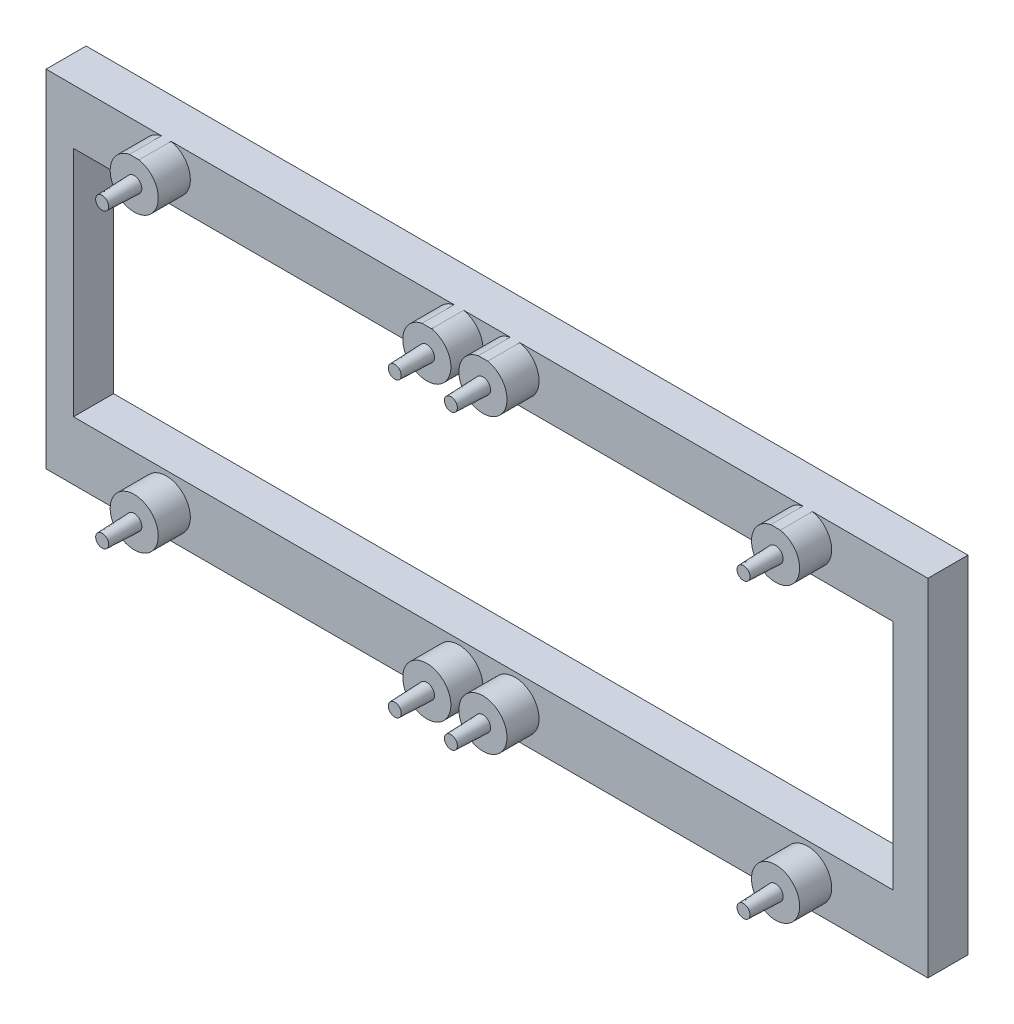
from build123d import *

# Parameters (mm, degrees)
SKIZZE1_W                                  = 110
SKIZZE1_H                                  = 170
AUFSATZ_LINEAR_AUSTRAGEN1_DEPTH            = 5
VERRUNDUNG1_R                              = 5
SKIZZE7_W                                  = 12
SKIZZE7_H                                  = 16
AUFSATZ_LINEAR_AUSTRAGEN3_DEPTH            = 28
VERRUNDUNG2_R                              = 2
SKIZZE8_R                                  = 4.2
SCHNITT_LINEAR_AUSTRAGEN3_DEPTH            = 107.484740691
LINEARES_MUSTER1_COUNT                     = 2
LINEARES_MUSTER1_PITCH                     = 134
LINEARES_MUSTER1_COUNT_DIR2                = 2
LINEARES_MUSTER1_PITCH_DIR2                = 98
SKIZZE9_R                                  = 3
AUFSATZ_LINEAR_AUSTRAGEN4_DEPTH            = 4
SKIZZE10_R                                 = 0.95
AUFSATZ_LINEAR_AUSTRAGEN5_DEPTH            = 4
AUFSATZ_LINEAR_AUSTRAGEN5_DRAFT            = 2
AUFSATZ_LINEAR_AUSTRAGEN5_PROFILE_2_DEPTH  = 4
AUFSATZ_LINEAR_AUSTRAGEN5_PROFILE_2_DRAFT  = 2
AUFSATZ_LINEAR_AUSTRAGEN5_PROFILE_3_DEPTH  = 4
AUFSATZ_LINEAR_AUSTRAGEN5_PROFILE_3_DRAFT  = 2
AUFSATZ_LINEAR_AUSTRAGEN5_PROFILE_4_DEPTH  = 4
AUFSATZ_LINEAR_AUSTRAGEN5_PROFILE_4_DRAFT  = 2
AUFSATZ_LINEAR_AUSTRAGEN5_PROFILE_5_DEPTH  = 4
AUFSATZ_LINEAR_AUSTRAGEN5_PROFILE_5_DRAFT  = 2
AUFSATZ_LINEAR_AUSTRAGEN5_PROFILE_6_DEPTH  = 4
AUFSATZ_LINEAR_AUSTRAGEN5_PROFILE_6_DRAFT  = 2
AUFSATZ_LINEAR_AUSTRAGEN5_PROFILE_7_DEPTH  = 4
AUFSATZ_LINEAR_AUSTRAGEN5_PROFILE_7_DRAFT  = 2
AUFSATZ_LINEAR_AUSTRAGEN5_PROFILE_8_DEPTH  = 4
AUFSATZ_LINEAR_AUSTRAGEN5_PROFILE_8_DRAFT  = 2
AUFSATZ_LINEAR_AUSTRAGEN5_PROFILE_9_DEPTH  = 4
AUFSATZ_LINEAR_AUSTRAGEN5_PROFILE_9_DRAFT  = 2
AUFSATZ_LINEAR_AUSTRAGEN5_PROFILE_10_DEPTH = 4
AUFSATZ_LINEAR_AUSTRAGEN5_PROFILE_10_DRAFT = 2
AUFSATZ_LINEAR_AUSTRAGEN5_PROFILE_11_DEPTH = 4
AUFSATZ_LINEAR_AUSTRAGEN5_PROFILE_11_DRAFT = 2
AUFSATZ_LINEAR_AUSTRAGEN5_PROFILE_12_DEPTH = 4
AUFSATZ_LINEAR_AUSTRAGEN5_PROFILE_12_DRAFT = 2
FASE1_SIZE                                 = 1.2
SKIZZE11_W                                 = 60
SKIZZE11_H                                 = 20
SCHNITT_LINEAR_AUSTRAGEN4_DEPTH            = 106.0428484
SKIZZE12_R                                 = 1.75
AUFSATZ_LINEAR_AUSTRAGEN6_DEPTH            = 4
AUFSATZ_LINEAR_AUSTRAGEN6_DRAFT            = 2
AUFSATZ_LINEAR_AUSTRAGEN6_PROFILE_2_DEPTH  = 4
AUFSATZ_LINEAR_AUSTRAGEN6_PROFILE_2_DRAFT  = 2
AUFSATZ_LINEAR_AUSTRAGEN6_PROFILE_3_DEPTH  = 4
AUFSATZ_LINEAR_AUSTRAGEN6_PROFILE_3_DRAFT  = 2
AUFSATZ_LINEAR_AUSTRAGEN6_PROFILE_4_DEPTH  = 4
AUFSATZ_LINEAR_AUSTRAGEN6_PROFILE_4_DRAFT  = 2
SKIZZE13_R                                 = 2
SCHNITT_LINEAR_AUSTRAGEN5_DEPTH            = 4.5
SKIZZE15_W                                 = 8
SKIZZE15_H                                 = 50
SCHNITT_LINEAR_AUSTRAGEN6_DEPTH            = 107.179093987
VERRUNDUNG3_R                              = 1
SCHNITT_LINEAR_AUSTRAGEN7_DEPTH            = 107.179093987
SCHNITT_LINEAR_AUSTRAGEN7_DEPTH_BACK       = 107.179093987
SKIZZE16_W                                 = 135.64748715
SKIZZE16_H                                 = 104.662159392
SKIZZE16_H_2                               = 34.255387719
SKIZZE16_W_2                               = 102.195469564
SKIZZE16_H_3                               = 29.000658893


with BuildPart() as part:
    # Skizze1 → Aufsatz-Linear austragen1 (new body)
    with BuildSketch(Plane.XY):
        Rectangle(SKIZZE1_W, SKIZZE1_H)
    extrude(amount=AUFSATZ_LINEAR_AUSTRAGEN1_DEPTH)

    # Verrundung1
    verrundung1_edges = [part.edges().sort_by_distance(p)[0] for p in [
        (55, -85, 2.5),
        (-55, -85, 2.5),
        (-55, 85, 2.5),
        (55, 85, 2.5),
    ]]
    fillet(verrundung1_edges, radius=VERRUNDUNG1_R)

    # Skizze7 → Aufsatz-Linear austragen3 (add)
    with BuildSketch(Plane.XY.offset(5)):
        with Locations((-49, 65)):
            Rectangle(SKIZZE7_W, SKIZZE7_H)
        with Locations((49, 65)):
            Rectangle(SKIZZE7_W, SKIZZE7_H)
        with Locations((49, -65)):
            Rectangle(SKIZZE7_W, SKIZZE7_H)
        with Locations((-49, -65)):
            Rectangle(SKIZZE7_W, SKIZZE7_H)
    extrude(amount=AUFSATZ_LINEAR_AUSTRAGEN3_DEPTH)

    # Verrundung2
    verrundung2_edges = [part.edges().sort_by_distance(p)[0] for p in [
        (-49, 57, 5),
        (-43, 65, 5),
        (-49, 73, 5),
        (49, 73, 5),
        (43, 65, 5),
        (49, 57, 5),
        (49, -57, 5),
        (43, -65, 5),
        (49, -73, 5),
        (-49, -73, 5),
        (-43, -65, 5),
        (-49, -57, 5),
    ]]
    fillet(verrundung2_edges, radius=VERRUNDUNG2_R)

    # Skizze8 → Schnitt-Linear austragen3 (cut, through all)
    with BuildSketch(Plane.XY.offset(33)):
        with Locations((-49, 67)):
            Circle(SKIZZE8_R)
    schnitt_linear_austragen3 = extrude(amount=-SCHNITT_LINEAR_AUSTRAGEN3_DEPTH, mode=Mode.SUBTRACT)

    # Lineares Muster1: Schnitt-Linear austragen3 2 × 2
    with Locations(*[(j * LINEARES_MUSTER1_PITCH_DIR2, -i * LINEARES_MUSTER1_PITCH, 0) for i in range(LINEARES_MUSTER1_COUNT) for j in range(LINEARES_MUSTER1_COUNT_DIR2) if (i, j) != (0, 0)]):
        add(schnitt_linear_austragen3, mode=Mode.SUBTRACT)

    # Skizze9 → Aufsatz-Linear austragen4 (add)
    with BuildSketch(Plane.XY.offset(5)):
        with Locations(Location((24.75, -73.75, 0), (0, 0, 180))):
            Circle(SKIZZE9_R)
        with Locations(Location((24.75, -16.25, 0), (0, 0, 180))):
            Circle(SKIZZE9_R)
        with Locations(Location((-24.75, -16.25, 0), (0, 0, 180))):
            Circle(SKIZZE9_R)
        with Locations(Location((-24.75, -73.75, 0), (0, 0, 180))):
            Circle(SKIZZE9_R)
        with Locations(Location((-3.5, 52, 0), (0, 0, 180))):
            Circle(SKIZZE9_R)
        with Locations(Location((-40, 52, 0), (0, 0, 180))):
            Circle(SKIZZE9_R)
        with Locations(Location((-40, 15.5, 0), (0, 0, 180))):
            Circle(SKIZZE9_R)
        with Locations(Location((-3.5, 15.5, 0), (0, 0, 180))):
            Circle(SKIZZE9_R)
        with Locations(Location((3.5, 15.5, 0), (0, 0, 180))):
            Circle(SKIZZE9_R)
        with Locations(Location((40, 15.5, 0), (0, 0, 180))):
            Circle(SKIZZE9_R)
        with Locations(Location((40, 52, 0), (0, 0, 180))):
            Circle(SKIZZE9_R)
        with Locations(Location((3.5, 52, 0), (0, 0, 180))):
            Circle(SKIZZE9_R)
    extrude(amount=AUFSATZ_LINEAR_AUSTRAGEN4_DEPTH)


with BuildPart() as aufsatz_linear_austragen5_tool:
    # Skizze10 → Aufsatz-Linear austragen5 (with draft: the straight prism first)
    with BuildSketch(Plane.XY.offset(9)):
        with Locations((24.75, -73.75)):
            Circle(SKIZZE10_R)
    extrude(amount=AUFSATZ_LINEAR_AUSTRAGEN5_DEPTH)
    # Aufsatz-Linear austragen5: the draft: its side faces are tilted about the plane it starts from
    aufsatz_linear_austragen5_sides = [aufsatz_linear_austragen5_tool.faces().sort_by_distance(p)[0] for p in [
        (23.8, -73.75, 11),
    ]]
    draft(aufsatz_linear_austragen5_sides, Plane.XY.offset(9), AUFSATZ_LINEAR_AUSTRAGEN5_DRAFT)


with BuildPart() as part_1:
    add(part.part)

    # Aufsatz-Linear austragen5: add aufsatz_linear_austragen5_tool
    add(aufsatz_linear_austragen5_tool.part)


with BuildPart() as aufsatz_linear_austragen5_profile_2_tool:
    # Skizze10 → Aufsatz-Linear austragen5 profile 2 (with draft: the straight prism first)
    with BuildSketch(Plane.XY.offset(9)):
        with Locations((24.75, -16.25)):
            Circle(SKIZZE10_R)
    extrude(amount=AUFSATZ_LINEAR_AUSTRAGEN5_PROFILE_2_DEPTH)
    # Aufsatz-Linear austragen5 profile 2: the draft: its side faces are tilted about the plane it starts from
    aufsatz_linear_austragen5_profile_2_sides = [aufsatz_linear_austragen5_profile_2_tool.faces().sort_by_distance(p)[0] for p in [
        (23.8, -16.25, 11),
    ]]
    draft(aufsatz_linear_austragen5_profile_2_sides, Plane.XY.offset(9), AUFSATZ_LINEAR_AUSTRAGEN5_PROFILE_2_DRAFT)


with BuildPart() as part_2:
    add(part_1.part)

    # Aufsatz-Linear austragen5 profile 2: add aufsatz_linear_austragen5_profile_2_tool
    add(aufsatz_linear_austragen5_profile_2_tool.part)


with BuildPart() as aufsatz_linear_austragen5_profile_3_tool:
    # Skizze10 → Aufsatz-Linear austragen5 profile 3 (with draft: the straight prism first)
    with BuildSketch(Plane.XY.offset(9)):
        with Locations((-24.75, -16.25)):
            Circle(SKIZZE10_R)
    extrude(amount=AUFSATZ_LINEAR_AUSTRAGEN5_PROFILE_3_DEPTH)
    # Aufsatz-Linear austragen5 profile 3: the draft: its side faces are tilted about the plane it starts from
    aufsatz_linear_austragen5_profile_3_sides = [aufsatz_linear_austragen5_profile_3_tool.faces().sort_by_distance(p)[0] for p in [
        (-25.7, -16.25, 11),
    ]]
    draft(aufsatz_linear_austragen5_profile_3_sides, Plane.XY.offset(9), AUFSATZ_LINEAR_AUSTRAGEN5_PROFILE_3_DRAFT)


with BuildPart() as part_3:
    add(part_2.part)

    # Aufsatz-Linear austragen5 profile 3: add aufsatz_linear_austragen5_profile_3_tool
    add(aufsatz_linear_austragen5_profile_3_tool.part)


with BuildPart() as aufsatz_linear_austragen5_profile_4_tool:
    # Skizze10 → Aufsatz-Linear austragen5 profile 4 (with draft: the straight prism first)
    with BuildSketch(Plane.XY.offset(9)):
        with Locations((-24.75, -73.75)):
            Circle(SKIZZE10_R)
    extrude(amount=AUFSATZ_LINEAR_AUSTRAGEN5_PROFILE_4_DEPTH)
    # Aufsatz-Linear austragen5 profile 4: the draft: its side faces are tilted about the plane it starts from
    aufsatz_linear_austragen5_profile_4_sides = [aufsatz_linear_austragen5_profile_4_tool.faces().sort_by_distance(p)[0] for p in [
        (-25.7, -73.75, 11),
    ]]
    draft(aufsatz_linear_austragen5_profile_4_sides, Plane.XY.offset(9), AUFSATZ_LINEAR_AUSTRAGEN5_PROFILE_4_DRAFT)


with BuildPart() as part_4:
    add(part_3.part)

    # Aufsatz-Linear austragen5 profile 4: add aufsatz_linear_austragen5_profile_4_tool
    add(aufsatz_linear_austragen5_profile_4_tool.part)


with BuildPart() as aufsatz_linear_austragen5_profile_5_tool:
    # Skizze10 → Aufsatz-Linear austragen5 profile 5 (with draft: the straight prism first)
    with BuildSketch(Plane.XY.offset(9)):
        with Locations((3.5, 15.5)):
            Circle(SKIZZE10_R)
    extrude(amount=AUFSATZ_LINEAR_AUSTRAGEN5_PROFILE_5_DEPTH)
    # Aufsatz-Linear austragen5 profile 5: the draft: its side faces are tilted about the plane it starts from
    aufsatz_linear_austragen5_profile_5_sides = [aufsatz_linear_austragen5_profile_5_tool.faces().sort_by_distance(p)[0] for p in [
        (2.55, 15.5, 11),
    ]]
    draft(aufsatz_linear_austragen5_profile_5_sides, Plane.XY.offset(9), AUFSATZ_LINEAR_AUSTRAGEN5_PROFILE_5_DRAFT)


with BuildPart() as part_5:
    add(part_4.part)

    # Aufsatz-Linear austragen5 profile 5: add aufsatz_linear_austragen5_profile_5_tool
    add(aufsatz_linear_austragen5_profile_5_tool.part)


with BuildPart() as aufsatz_linear_austragen5_profile_6_tool:
    # Skizze10 → Aufsatz-Linear austragen5 profile 6 (with draft: the straight prism first)
    with BuildSketch(Plane.XY.offset(9)):
        with Locations((40, 15.5)):
            Circle(SKIZZE10_R)
    extrude(amount=AUFSATZ_LINEAR_AUSTRAGEN5_PROFILE_6_DEPTH)
    # Aufsatz-Linear austragen5 profile 6: the draft: its side faces are tilted about the plane it starts from
    aufsatz_linear_austragen5_profile_6_sides = [aufsatz_linear_austragen5_profile_6_tool.faces().sort_by_distance(p)[0] for p in [
        (39.05, 15.5, 11),
    ]]
    draft(aufsatz_linear_austragen5_profile_6_sides, Plane.XY.offset(9), AUFSATZ_LINEAR_AUSTRAGEN5_PROFILE_6_DRAFT)


with BuildPart() as part_6:
    add(part_5.part)

    # Aufsatz-Linear austragen5 profile 6: add aufsatz_linear_austragen5_profile_6_tool
    add(aufsatz_linear_austragen5_profile_6_tool.part)


with BuildPart() as aufsatz_linear_austragen5_profile_7_tool:
    # Skizze10 → Aufsatz-Linear austragen5 profile 7 (with draft: the straight prism first)
    with BuildSketch(Plane.XY.offset(9)):
        with Locations((40, 52)):
            Circle(SKIZZE10_R)
    extrude(amount=AUFSATZ_LINEAR_AUSTRAGEN5_PROFILE_7_DEPTH)
    # Aufsatz-Linear austragen5 profile 7: the draft: its side faces are tilted about the plane it starts from
    aufsatz_linear_austragen5_profile_7_sides = [aufsatz_linear_austragen5_profile_7_tool.faces().sort_by_distance(p)[0] for p in [
        (39.05, 52, 11),
    ]]
    draft(aufsatz_linear_austragen5_profile_7_sides, Plane.XY.offset(9), AUFSATZ_LINEAR_AUSTRAGEN5_PROFILE_7_DRAFT)


with BuildPart() as part_7:
    add(part_6.part)

    # Aufsatz-Linear austragen5 profile 7: add aufsatz_linear_austragen5_profile_7_tool
    add(aufsatz_linear_austragen5_profile_7_tool.part)


with BuildPart() as aufsatz_linear_austragen5_profile_8_tool:
    # Skizze10 → Aufsatz-Linear austragen5 profile 8 (with draft: the straight prism first)
    with BuildSketch(Plane.XY.offset(9)):
        with Locations((3.5, 52)):
            Circle(SKIZZE10_R)
    extrude(amount=AUFSATZ_LINEAR_AUSTRAGEN5_PROFILE_8_DEPTH)
    # Aufsatz-Linear austragen5 profile 8: the draft: its side faces are tilted about the plane it starts from
    aufsatz_linear_austragen5_profile_8_sides = [aufsatz_linear_austragen5_profile_8_tool.faces().sort_by_distance(p)[0] for p in [
        (2.55, 52, 11),
    ]]
    draft(aufsatz_linear_austragen5_profile_8_sides, Plane.XY.offset(9), AUFSATZ_LINEAR_AUSTRAGEN5_PROFILE_8_DRAFT)


with BuildPart() as part_8:
    add(part_7.part)

    # Aufsatz-Linear austragen5 profile 8: add aufsatz_linear_austragen5_profile_8_tool
    add(aufsatz_linear_austragen5_profile_8_tool.part)


with BuildPart() as aufsatz_linear_austragen5_profile_9_tool:
    # Skizze10 → Aufsatz-Linear austragen5 profile 9 (with draft: the straight prism first)
    with BuildSketch(Plane.XY.offset(9)):
        with Locations((-3.5, 52)):
            Circle(SKIZZE10_R)
    extrude(amount=AUFSATZ_LINEAR_AUSTRAGEN5_PROFILE_9_DEPTH)
    # Aufsatz-Linear austragen5 profile 9: the draft: its side faces are tilted about the plane it starts from
    aufsatz_linear_austragen5_profile_9_sides = [aufsatz_linear_austragen5_profile_9_tool.faces().sort_by_distance(p)[0] for p in [
        (-4.45, 52, 11),
    ]]
    draft(aufsatz_linear_austragen5_profile_9_sides, Plane.XY.offset(9), AUFSATZ_LINEAR_AUSTRAGEN5_PROFILE_9_DRAFT)


with BuildPart() as part_9:
    add(part_8.part)

    # Aufsatz-Linear austragen5 profile 9: add aufsatz_linear_austragen5_profile_9_tool
    add(aufsatz_linear_austragen5_profile_9_tool.part)


with BuildPart() as aufsatz_linear_austragen5_profile_10_tool:
    # Skizze10 → Aufsatz-Linear austragen5 profile 10 (with draft: the straight prism first)
    with BuildSketch(Plane.XY.offset(9)):
        with Locations((-40, 52)):
            Circle(SKIZZE10_R)
    extrude(amount=AUFSATZ_LINEAR_AUSTRAGEN5_PROFILE_10_DEPTH)
    # Aufsatz-Linear austragen5 profile 10: the draft: its side faces are tilted about the plane it starts from
    aufsatz_linear_austragen5_profile_10_sides = [aufsatz_linear_austragen5_profile_10_tool.faces().sort_by_distance(p)[0] for p in [
        (-40.95, 52, 11),
    ]]
    draft(aufsatz_linear_austragen5_profile_10_sides, Plane.XY.offset(9), AUFSATZ_LINEAR_AUSTRAGEN5_PROFILE_10_DRAFT)


with BuildPart() as part_10:
    add(part_9.part)

    # Aufsatz-Linear austragen5 profile 10: add aufsatz_linear_austragen5_profile_10_tool
    add(aufsatz_linear_austragen5_profile_10_tool.part)


with BuildPart() as aufsatz_linear_austragen5_profile_11_tool:
    # Skizze10 → Aufsatz-Linear austragen5 profile 11 (with draft: the straight prism first)
    with BuildSketch(Plane.XY.offset(9)):
        with Locations((-40, 15.5)):
            Circle(SKIZZE10_R)
    extrude(amount=AUFSATZ_LINEAR_AUSTRAGEN5_PROFILE_11_DEPTH)
    # Aufsatz-Linear austragen5 profile 11: the draft: its side faces are tilted about the plane it starts from
    aufsatz_linear_austragen5_profile_11_sides = [aufsatz_linear_austragen5_profile_11_tool.faces().sort_by_distance(p)[0] for p in [
        (-40.95, 15.5, 11),
    ]]
    draft(aufsatz_linear_austragen5_profile_11_sides, Plane.XY.offset(9), AUFSATZ_LINEAR_AUSTRAGEN5_PROFILE_11_DRAFT)


with BuildPart() as part_11:
    add(part_10.part)

    # Aufsatz-Linear austragen5 profile 11: add aufsatz_linear_austragen5_profile_11_tool
    add(aufsatz_linear_austragen5_profile_11_tool.part)


with BuildPart() as aufsatz_linear_austragen5_profile_12_tool:
    # Skizze10 → Aufsatz-Linear austragen5 profile 12 (with draft: the straight prism first)
    with BuildSketch(Plane.XY.offset(9)):
        with Locations((-3.5, 15.5)):
            Circle(SKIZZE10_R)
    extrude(amount=AUFSATZ_LINEAR_AUSTRAGEN5_PROFILE_12_DEPTH)
    # Aufsatz-Linear austragen5 profile 12: the draft: its side faces are tilted about the plane it starts from
    aufsatz_linear_austragen5_profile_12_sides = [aufsatz_linear_austragen5_profile_12_tool.faces().sort_by_distance(p)[0] for p in [
        (-4.45, 15.5, 11),
    ]]
    draft(aufsatz_linear_austragen5_profile_12_sides, Plane.XY.offset(9), AUFSATZ_LINEAR_AUSTRAGEN5_PROFILE_12_DRAFT)


with BuildPart() as part_12:
    add(part_11.part)

    # Aufsatz-Linear austragen5 profile 12: add aufsatz_linear_austragen5_profile_12_tool
    add(aufsatz_linear_austragen5_profile_12_tool.part)

    # Fase1
    fase1_edges = [part_12.edges().sort_by_distance(p)[0] for p in [
        (-53.2, 67, 33),
        (44.8, 67, 33),
        (-53.2, -67, 33),
        (44.8, -67, 33),
    ]]
    chamfer(fase1_edges, length=FASE1_SIZE)

    # Skizze11 → Schnitt-Linear austragen4 (cut, through all)
    with BuildSketch(Plane.XY.offset(5)):
        with Locations((0, 69)):
            Rectangle(SKIZZE11_W, SKIZZE11_H)
    extrude(amount=-SCHNITT_LINEAR_AUSTRAGEN4_DEPTH, mode=Mode.SUBTRACT)


with BuildPart() as aufsatz_linear_austragen6_tool:
    # Skizze12 → Aufsatz-Linear austragen6 (with draft: the straight prism first)
    with BuildSketch(Plane.XY.offset(33)):
        with Locations((-49, 59.5)):
            Circle(SKIZZE12_R)
    extrude(amount=AUFSATZ_LINEAR_AUSTRAGEN6_DEPTH)
    # Aufsatz-Linear austragen6: the draft: its side faces are tilted about the plane it starts from
    aufsatz_linear_austragen6_sides = [aufsatz_linear_austragen6_tool.faces().sort_by_distance(p)[0] for p in [
        (-50.75, 59.5, 35),
    ]]
    draft(aufsatz_linear_austragen6_sides, Plane.XY.offset(33), AUFSATZ_LINEAR_AUSTRAGEN6_DRAFT)


with BuildPart() as part_13:
    add(part_12.part)

    # Aufsatz-Linear austragen6: add aufsatz_linear_austragen6_tool
    add(aufsatz_linear_austragen6_tool.part)


with BuildPart() as aufsatz_linear_austragen6_profile_2_tool:
    # Skizze12 → Aufsatz-Linear austragen6 profile 2 (with draft: the straight prism first)
    with BuildSketch(Plane.XY.offset(33)):
        with Locations((49, 59.5)):
            Circle(SKIZZE12_R)
    extrude(amount=AUFSATZ_LINEAR_AUSTRAGEN6_PROFILE_2_DEPTH)
    # Aufsatz-Linear austragen6 profile 2: the draft: its side faces are tilted about the plane it starts from
    aufsatz_linear_austragen6_profile_2_sides = [aufsatz_linear_austragen6_profile_2_tool.faces().sort_by_distance(p)[0] for p in [
        (47.25, 59.5, 35),
    ]]
    draft(aufsatz_linear_austragen6_profile_2_sides, Plane.XY.offset(33), AUFSATZ_LINEAR_AUSTRAGEN6_PROFILE_2_DRAFT)


with BuildPart() as part_14:
    add(part_13.part)

    # Aufsatz-Linear austragen6 profile 2: add aufsatz_linear_austragen6_profile_2_tool
    add(aufsatz_linear_austragen6_profile_2_tool.part)


with BuildPart() as aufsatz_linear_austragen6_profile_3_tool:
    # Skizze12 → Aufsatz-Linear austragen6 profile 3 (with draft: the straight prism first)
    with BuildSketch(Plane.XY.offset(33)):
        with Locations((-49, -59.5)):
            Circle(SKIZZE12_R)
    extrude(amount=AUFSATZ_LINEAR_AUSTRAGEN6_PROFILE_3_DEPTH)
    # Aufsatz-Linear austragen6 profile 3: the draft: its side faces are tilted about the plane it starts from
    aufsatz_linear_austragen6_profile_3_sides = [aufsatz_linear_austragen6_profile_3_tool.faces().sort_by_distance(p)[0] for p in [
        (-50.75, -59.5, 35),
    ]]
    draft(aufsatz_linear_austragen6_profile_3_sides, Plane.XY.offset(33), AUFSATZ_LINEAR_AUSTRAGEN6_PROFILE_3_DRAFT)


with BuildPart() as part_15:
    add(part_14.part)

    # Aufsatz-Linear austragen6 profile 3: add aufsatz_linear_austragen6_profile_3_tool
    add(aufsatz_linear_austragen6_profile_3_tool.part)


with BuildPart() as aufsatz_linear_austragen6_profile_4_tool:
    # Skizze12 → Aufsatz-Linear austragen6 profile 4 (with draft: the straight prism first)
    with BuildSketch(Plane.XY.offset(33)):
        with Locations((49, -59.5)):
            Circle(SKIZZE12_R)
    extrude(amount=AUFSATZ_LINEAR_AUSTRAGEN6_PROFILE_4_DEPTH)
    # Aufsatz-Linear austragen6 profile 4: the draft: its side faces are tilted about the plane it starts from
    aufsatz_linear_austragen6_profile_4_sides = [aufsatz_linear_austragen6_profile_4_tool.faces().sort_by_distance(p)[0] for p in [
        (47.25, -59.5, 35),
    ]]
    draft(aufsatz_linear_austragen6_profile_4_sides, Plane.XY.offset(33), AUFSATZ_LINEAR_AUSTRAGEN6_PROFILE_4_DRAFT)


with BuildPart() as part_16:
    add(part_15.part)

    # Aufsatz-Linear austragen6 profile 4: add aufsatz_linear_austragen6_profile_4_tool
    add(aufsatz_linear_austragen6_profile_4_tool.part)

    # Skizze13 → Schnitt-Linear austragen5 (cut)
    with BuildSketch(Plane(origin=(0, 0, 0), x_dir=(-1, 0, 0), z_dir=(0, 0, -1))):
        with Locations((49, 59.5)):
            Circle(SKIZZE13_R)
        with Locations(Location((-49, 59.5, 0), (0, 0, 180))):
            Circle(SKIZZE13_R)
        with Locations((-49, -59.5)):
            Circle(SKIZZE13_R)
        with Locations(Location((49, -59.5, 0), (0, 0, 180))):
            Circle(SKIZZE13_R)
    extrude(amount=-SCHNITT_LINEAR_AUSTRAGEN5_DEPTH, mode=Mode.SUBTRACT)

    # Skizze15 → Schnitt-Linear austragen6 (cut, through all)
    with BuildSketch(Plane.XY.offset(5)):
        with Locations((44, -25)):
            Rectangle(SKIZZE15_W, SKIZZE15_H)
        with Locations((-44, -25)):
            Rectangle(SKIZZE15_W, SKIZZE15_H)
    extrude(amount=-SCHNITT_LINEAR_AUSTRAGEN6_DEPTH, mode=Mode.SUBTRACT)

    # Verrundung3
    verrundung3_edges = [part_16.edges().sort_by_distance(p)[0] for p in [
        (48, 0, 2.5),
        (48, -50, 2.5),
        (40, -50, 2.5),
        (40, 0, 2.5),
        (-48, -50, 2.5),
        (-48, 0, 2.5),
        (-40, 0, 2.5),
        (-40, -50, 2.5),
    ]]
    fillet(verrundung3_edges, radius=VERRUNDUNG3_R)

    # Skizze16 → Schnitt-Linear austragen7 (cut, two sides: drawn at the far end of the back side and taken through both)
    with BuildSketch(Plane.XY.offset(5).offset(-SCHNITT_LINEAR_AUSTRAGEN7_DEPTH_BACK)):
        with Locations((-4.200377562, -40.571388735)):
            Rectangle(SKIZZE16_W, SKIZZE16_H)
        with Locations((-4.200377562, 72.068559076)):
            Rectangle(SKIZZE16_W, SKIZZE16_H_2)
        with Locations((-0.479695711, 33.596057413)):
            Rectangle(SKIZZE16_W_2, SKIZZE16_H_3)
    extrude(amount=SCHNITT_LINEAR_AUSTRAGEN7_DEPTH + SCHNITT_LINEAR_AUSTRAGEN7_DEPTH_BACK, mode=Mode.SUBTRACT)


solid = part_16.part
